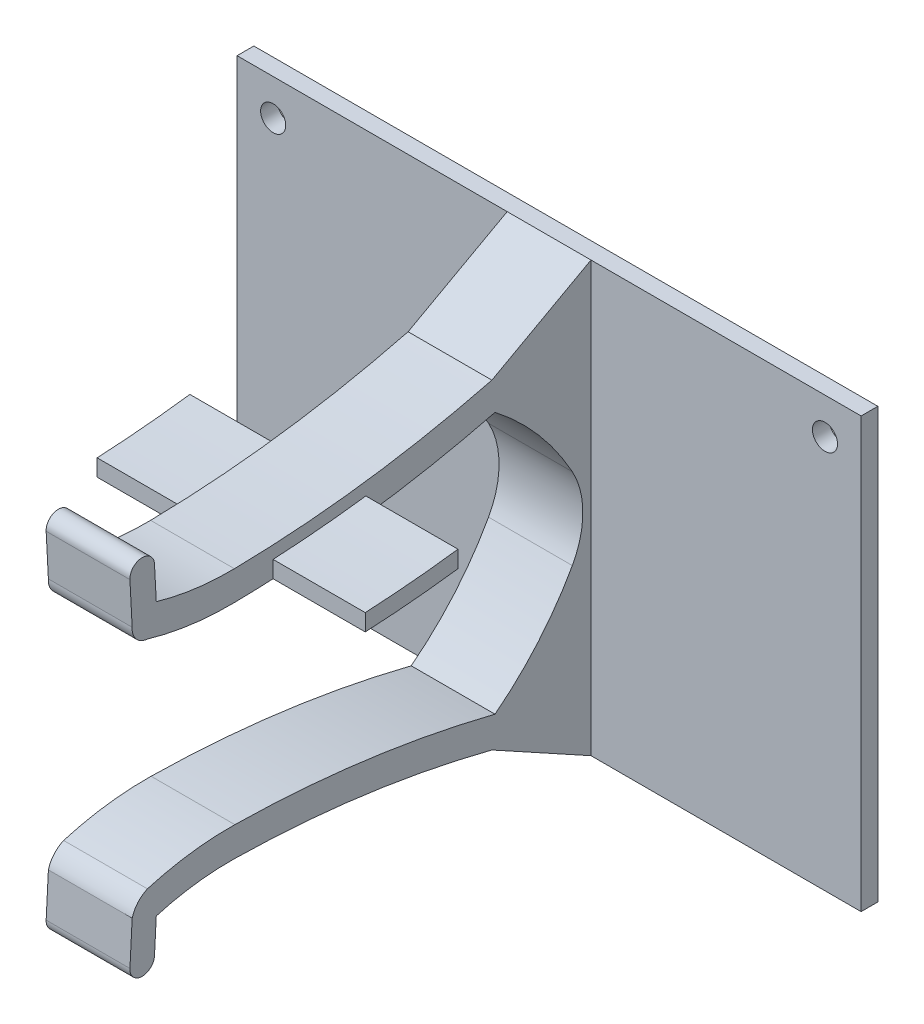
from build123d import *
from build123d.topology import SkipClean

# Parameters (mm, degrees)
SKETCH1_R                = 1.5
BOSS_EXTRUDE1_DEPTH      = 2
BOSS_EXTRUDE2_DEPTH      = 5
BOSS_EXTRUDE2_DEPTH_BACK = 5
BOSS_EXTRUDE3_DEPTH      = 16
BOSS_EXTRUDE3_DEPTH_BACK = 16


with BuildPart() as part:
    # Sketch1 → Boss-Extrude1 (new body)
    with BuildSketch(Plane.XY):
        Polygon((32.93, 4.3095034), (-32.93, 4.3095034), (-37.2395034, 4.3095034), (-37.2395034, -46.928143845), (37.2395034, -46.928143845), (37.2395034, 4.3095034), align=None)
        with Locations((1.941, -42.566)):
            Circle(SKETCH1_R, mode=Mode.SUBTRACT)
        with Locations((-32.93, 0)):
            Circle(SKETCH1_R, mode=Mode.SUBTRACT)
        with Locations((32.93, 0)):
            Circle(SKETCH1_R, mode=Mode.SUBTRACT)
    extrude(amount=BOSS_EXTRUDE1_DEPTH)

    # Sketch2 → Boss-Extrude2 (add, two sides: drawn at the far end of the back side and taken through both)
    with BuildSketch(Plane(origin=(0, 0, 0), x_dir=(0, 0, -1), z_dir=(1, 0, 0)).offset(-BOSS_EXTRUDE2_DEPTH_BACK)):
        with BuildLine():
            Line((-13.827857709, -2.193698586), (-2, 4.3095034))
            Line((-2, 4.3095034), (0, 4.3095034))
            Line((0, 4.3095034), (0, -46.928143845))
            Line((0, -46.928143845), (-2, -46.928143845))
            Line((-2, -46.928143845), (-13.827857709, -40.424941859))
            ThreePointArc((-13.827857709, -40.424941859), (-29.0735826, -37.459870422), (-44.561553332, -36.299465883))
            ThreePointArc((-44.561553332, -36.299465883), (-49.270202349, -36.576792482), (-53.884612562, -37.55429133))
            Line((-53.884612562, -37.55429133), (-54.096567625, -41.562549641))
            ThreePointArc((-54.096567625, -41.562549641), (-55.64009753, -42.951035737), (-57.028583626, -41.407505832))
            Line((-57.028583626, -41.407505832), (-56.760743998, -36.342420783))
            ThreePointArc((-56.760743998, -36.342420783), (-56.091378633, -35.074236285), (-54.941875511, -34.216923926))
            ThreePointArc((-54.941875511, -34.216923926), (-49.777133912, -33.113502449), (-44.505153577, -32.799945311))
            ThreePointArc((-44.505153577, -32.799945311), (-28.861742138, -33.957189589), (-13.455691977, -36.908317202))
            ThreePointArc((-13.455691977, -36.908317202), (-8.292913419, -32.004111605), (-4.225812769, -26.159096012))
            ThreePointArc((-4.225812769, -26.159096012), (-2.971078619, -21.309320222), (-4.225812769, -16.459544433))
            ThreePointArc((-4.225812769, -16.459544433), (-8.292907204, -10.614536079), (-13.455676881, -5.710334914))
            ThreePointArc((-13.455676881, -5.710334914), (-28.861727042, -8.661462527), (-44.505138481, -9.818706805))
            ThreePointArc((-44.505138481, -9.818706805), (-49.777118817, -9.505149667), (-54.941860415, -8.40172819))
            ThreePointArc((-54.941860415, -8.40172819), (-56.291509436, -7.71567705), (-56.760743998, -6.276219662))
            Line((-56.760743998, -6.276219662), (-57.028583626, -1.211134613))
            ThreePointArc((-57.028583626, -1.211134613), (-55.64009753, 0.332395292), (-54.096567625, -1.056090804))
            Line((-54.096567625, -1.056090804), (-53.884612562, -5.064349115))
            ThreePointArc((-53.884612562, -5.064349115), (-49.270202349, -6.041847963), (-44.561553332, -6.319174562))
            ThreePointArc((-44.561553332, -6.319174562), (-29.0735826, -5.158770023), (-13.827857709, -2.193698586))
        make_face()
    extrude(amount=BOSS_EXTRUDE2_DEPTH + BOSS_EXTRUDE2_DEPTH_BACK)

    # Sketch5 → Boss-Extrude3 (add, two sides: drawn at the far end of the back side and taken through both)
    with SkipClean():  # the faces are left unmerged after this step: merging them gives an invalid solid
        with BuildSketch(Plane(origin=(0, 0, 0), x_dir=(0, 0, -1), z_dir=(1, 0, 0)).offset(-BOSS_EXTRUDE3_DEPTH_BACK)):
            with BuildLine():
                Line((-39.941860415, -7.665931491), (-39.941860415, -9.668427594))
                ThreePointArc((-39.941860415, -9.668427594), (-34.391490644, -9.278314981), (-28.861727042, -8.661462527))
                Line((-28.861727042, -8.661462527), (-28.874022965, -6.645436075))
                ThreePointArc((-28.874022965, -6.645436075), (-34.397354661, -7.270505974), (-39.941860415, -7.665931491))
            make_face()
        extrude(amount=BOSS_EXTRUDE3_DEPTH + BOSS_EXTRUDE3_DEPTH_BACK)


solid = part.part
